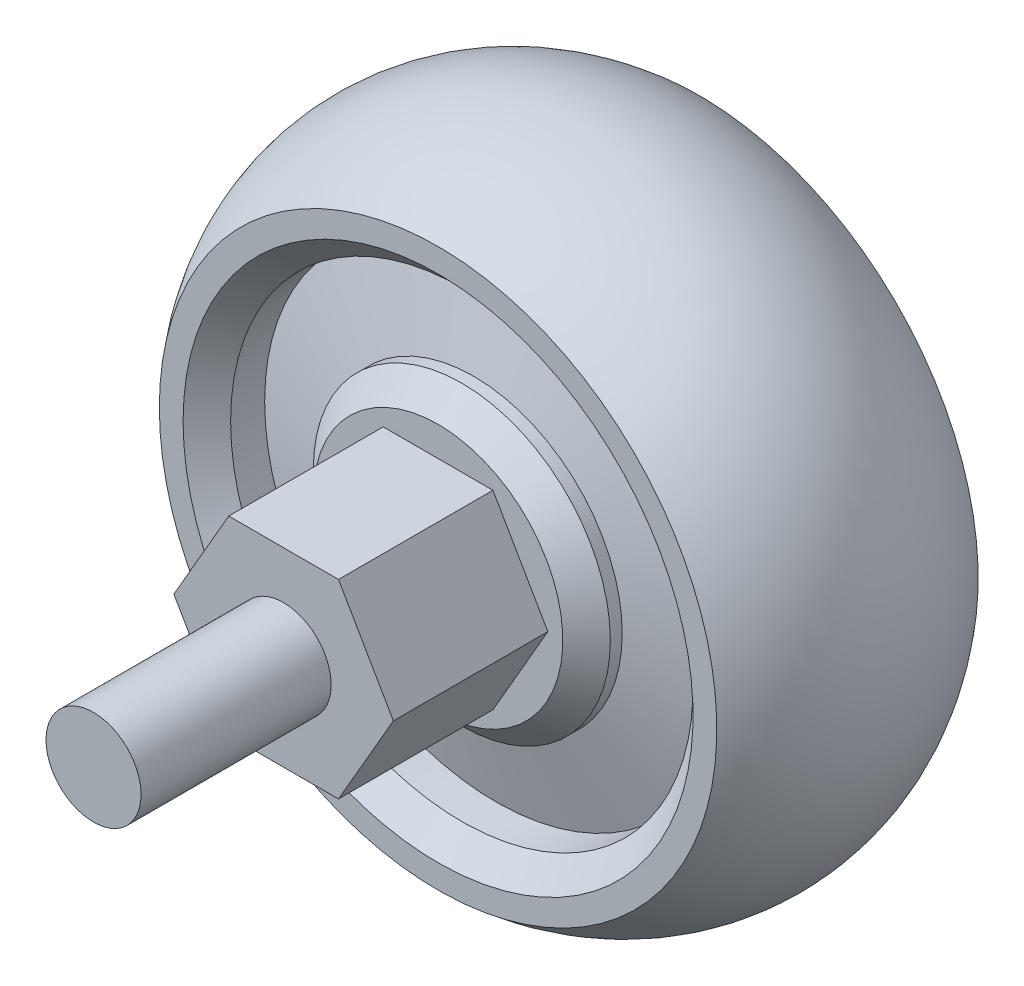
from build123d import *

# Parameters (mm, degrees)
SKETCH2_R          = 15.875
CUT_EXTRUDE1_DEPTH = 16.51
CHAMFER1_SIZE      = 2.54


with BuildPart() as part:
    # Sketch1 → Revolve1 (revolve)
    with BuildSketch(Plane(origin=(0, 0, 0), x_dir=(0, 0, -1), z_dir=(1, 0, 0)), mode=Mode.PRIVATE) as revolve1_sk:
        Polygon((10.16, 15.875), (7.791039386, 24.716081374), (-7.791039386, 24.716081374), (-10.16, 15.875), (-30.48, 15.875), (-30.48, 5.08), (-50.8, 5.08), (-50.8, 0), (13.97, 0), (13.97, 15.875), align=None)
    revolve(revolve1_sk.sketch.rotate(Axis((0, 0, 0), (0, 0, 1)), 90), axis=Axis((0, 0, 0), (0, 0, 1)))

    # Sketch1<3> → Revolve2 (revolve)
    with BuildSketch(Plane(origin=(0, 0, 0), x_dir=(0, 0, -1), z_dir=(1, 0, 0)), mode=Mode.PRIVATE) as revolve2_sk:
        with BuildLine():
            ThreePointArc((-13.97, 29.796081374), (0, 34.925), (13.97, 29.796081374))
            Line((13.97, 29.796081374), (13.97, 24.716081374))
            Line((13.97, 24.716081374), (-13.97, 24.716081374))
            Line((-13.97, 24.716081374), (-13.97, 29.796081374))
        make_face()
    revolve(revolve2_sk.sketch.rotate(Axis((0, 0, 0), (0, 0, 1)), 90), axis=Axis((0, 0, 0), (0, 0, 1)))

    # Sketch2 → Cut-Extrude1 (cut)
    with BuildSketch(Plane.XY.offset(30.48)):
        with Locations(Location((0, 0, 0), (0, 0, 180))):
            Circle(SKETCH2_R)
        Polygon((-5.865878735, 10.16), (-11.73175747, 0), (-5.865878735, -10.16), (5.865878735, -10.16), (11.73175747, 0), (5.865878735, 10.16), align=None, mode=Mode.SUBTRACT)
    extrude(amount=-CUT_EXTRUDE1_DEPTH, mode=Mode.SUBTRACT)

    # Chamfer1
    chamfer1_edges = [part.edges().sort_by_distance(p)[0] for p in [
        (24.716081374, 0, -13.97),
        (24.716081374, 0, 13.97),
        (15.875, 0, 13.97),
        (15.875, 0, -13.97),
    ]]
    chamfer(chamfer1_edges, length=CHAMFER1_SIZE)


solid = part.part
